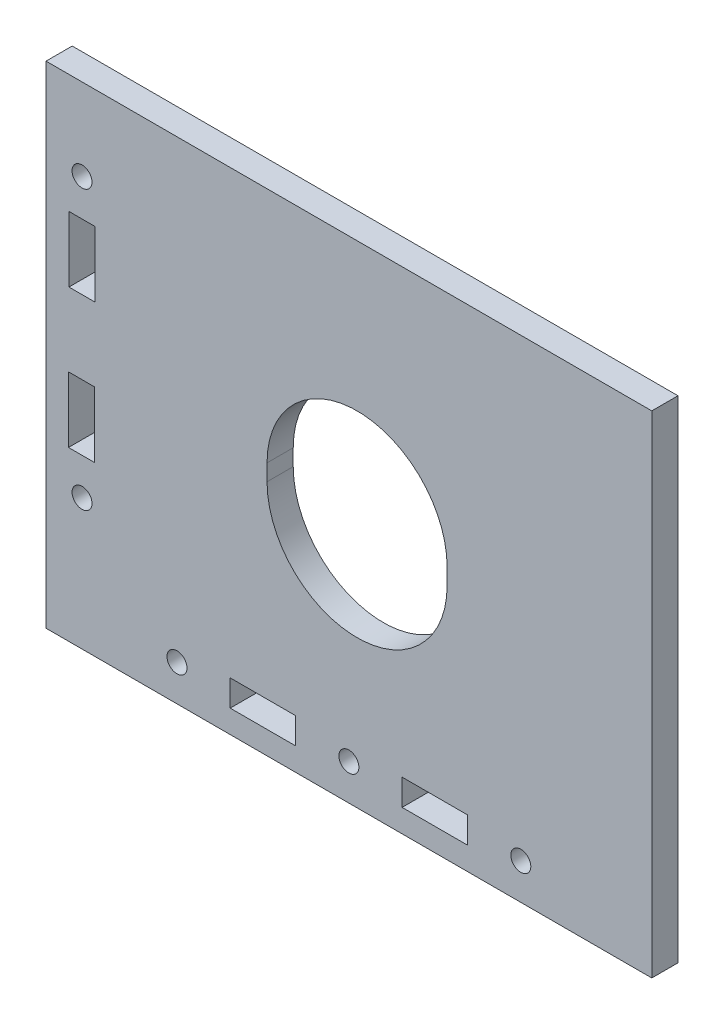
from build123d import *

# Parameters (mm, degrees)
MODEL_W             = 185
MODEL_H             = 150
MODEL_R             = 3.05
MODEL_W_2           = 20
MODEL_H_2           = 8
MODEL_W_3           = 8
MODEL_H_3           = 20
BOSS_EXTRUDE1_DEPTH = 8


with BuildPart() as part:
    # Model → Boss-Extrude1 (new body)
    with BuildSketch(Plane.XY):
        with Locations((77.5, 60)):
            Rectangle(MODEL_W, MODEL_H)
        with Locations((130, -4)):
            Circle(MODEL_R, mode=Mode.SUBTRACT)
        with Locations((25, -4)):
            Circle(MODEL_R, mode=Mode.SUBTRACT)
        with Locations((-4, 25)):
            Circle(MODEL_R, mode=Mode.SUBTRACT)
        with Locations((-4, 110)):
            Circle(MODEL_R, mode=Mode.SUBTRACT)
        with Locations((77.5, -4)):
            Circle(MODEL_R, mode=Mode.SUBTRACT)
        with Locations((103.75, -4)):
            Rectangle(MODEL_W_2, MODEL_H_2, mode=Mode.SUBTRACT)
        with BuildLine():
            Line((52.5, 57.5), (52.5, 62.5))
            ThreePointArc((52.5, 62.5), (80, 90), (107.5, 62.5))
            Line((107.5, 62.5), (107.5, 57.5))
            ThreePointArc((107.5, 57.5), (80, 30), (52.5, 57.5))
        make_face(mode=Mode.SUBTRACT)
        with Locations((51.25, -4)):
            Rectangle(MODEL_W_2, MODEL_H_2, mode=Mode.SUBTRACT)
        with Locations((-4, 88.75)):
            Rectangle(MODEL_W_3, MODEL_H_3, mode=Mode.SUBTRACT)
        with Locations((-4.13466, 46.25)):
            Rectangle(MODEL_W_3, MODEL_H_3, mode=Mode.SUBTRACT)
    extrude(amount=BOSS_EXTRUDE1_DEPTH)


solid = part.part
